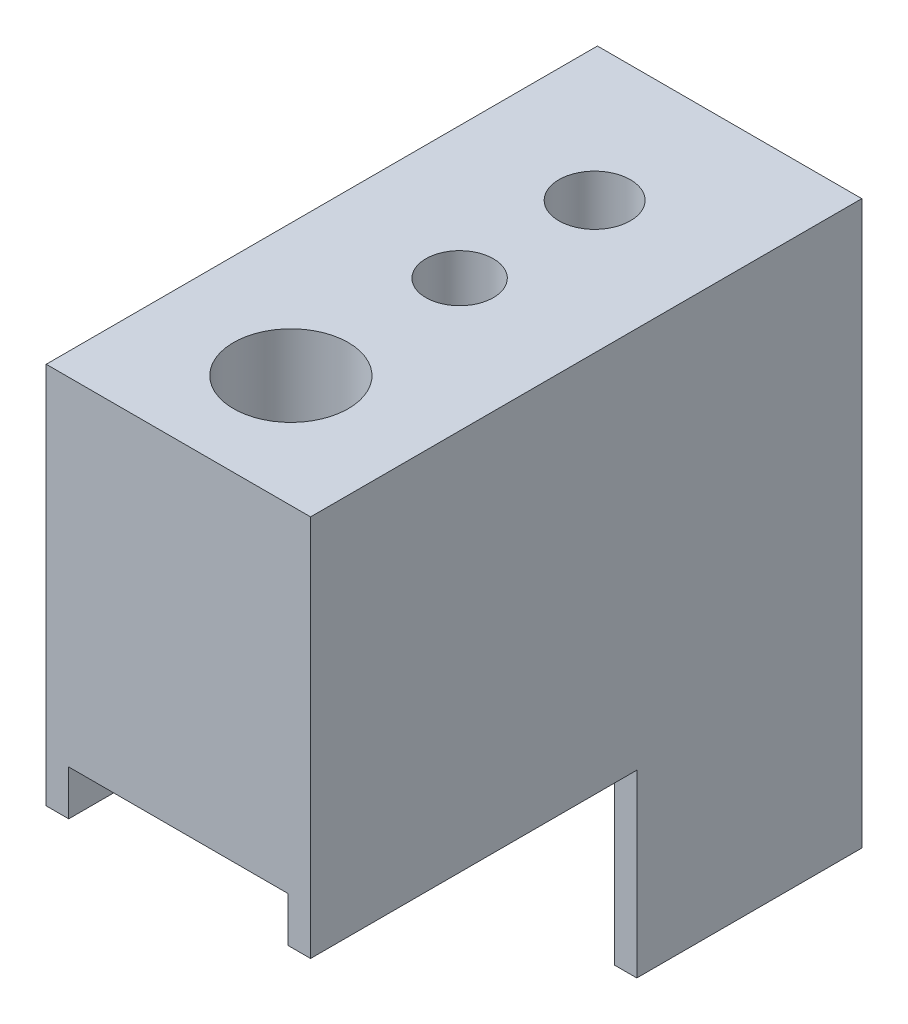
from build123d import *

# Parameters (mm, degrees)
BOSS_EXTRUDE1_DEPTH = 9.75
BOSS_EXTRUDE2_DEPTH = 2
SKETCH4_R           = 5.1
SKETCH4_R_2         = 3
SKETCH4_R_3         = 3.175
CUT_EXTRUDE1_DEPTH  = 55.534965848


with BuildPart() as part:
    # Sketch2 → Boss-Extrude1 (new, symmetric)
    with BuildSketch(Plane(origin=(0, 0, 0), x_dir=(0, 0, -1), z_dir=(1, 0, 0))):
        Polygon((-44, 0), (0, 0), (0, -20), (5, -20), (5, 30), (-44, 30), align=None)
    extrude(amount=BOSS_EXTRUDE1_DEPTH, both=True)

    # Sketch3 → Boss-Extrude2 (add)
    with BuildSketch(Plane(origin=(9.75, 0, 0), x_dir=(0, 0, -1), z_dir=(1, 0, 0))):
        Polygon((-44, 30), (-44, -4), (-15, -4), (-15, -20), (5, -20), (5, 30), align=None)
    boss_extrude2 = extrude(amount=BOSS_EXTRUDE2_DEPTH)

    # Mirror1: Boss-Extrude2 across plane
    add(boss_extrude2.mirror(Plane(origin=(0, 0, 0), x_dir=(0, 0, 1), z_dir=(1, 0, 0))))

    # Sketch4 → Cut-Extrude1 (cut, through all)
    with BuildSketch(Plane.XZ):
        with Locations(Location((0, 34, 0), (0, 0, 270))):
            Circle(SKETCH4_R)
        with Locations(Location((0, 19, 0), (0, 0, 270))):
            Circle(SKETCH4_R_2)
        with Locations(Location((0, 7, 0), (0, 0, 270))):
            Circle(SKETCH4_R_3)
    extrude(amount=-CUT_EXTRUDE1_DEPTH, mode=Mode.SUBTRACT)


solid = part.part
